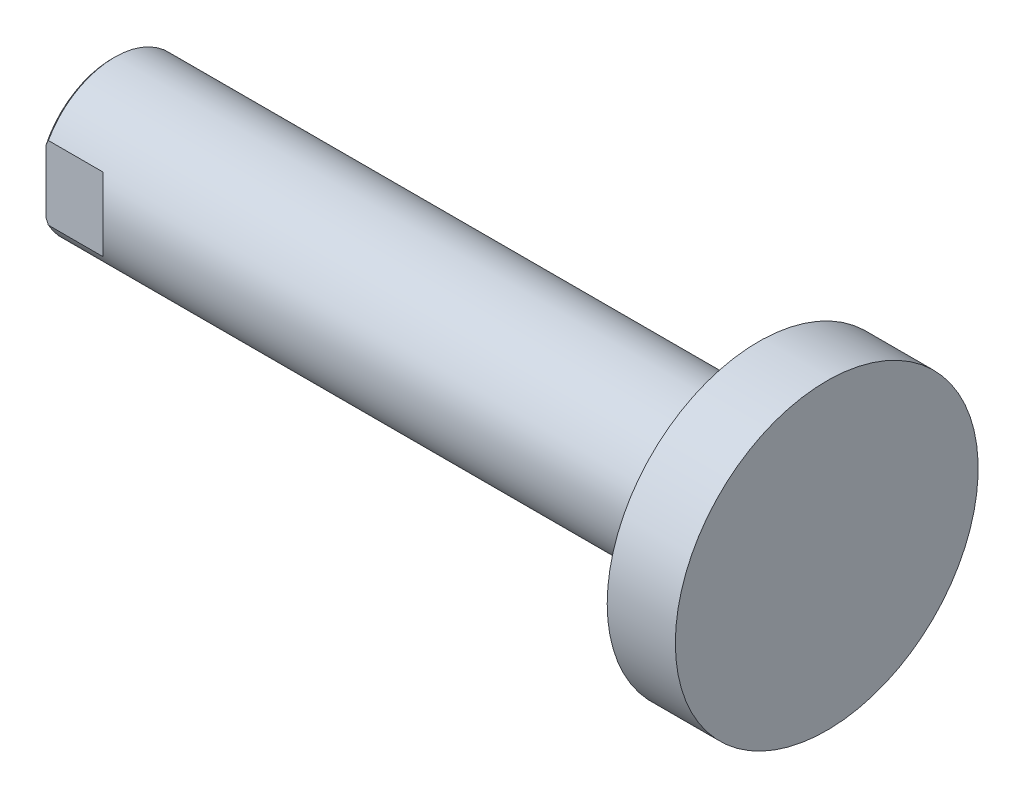
from build123d import *

# Parameters (mm, degrees)
CUT_EXTRUDE_1_DEPTH       = 14
CUT_EXTRUDE_1_DEPTH_BACK  = 14
HOLE_WIZARD_1_D           = 6.647
HOLE_WIZARD_1_DEPTH       = 15.6
HOLE_WIZARD_1_CSINK_D     = 8
HOLE_WIZARD_1_CSINK_ANGLE = 90
HOLE_WIZARD_1_TIP         = 1.91882362


with BuildPart() as part:
    # 草图1 → 旋转1 (revolve)
    with BuildSketch(Plane.XY):
        Polygon((-7, 0), (-7, 7.75), (-6.75, 8), (0, 8), (0, 0), align=None)
    revolve(axis=Axis((0, 0, 0), (-1, 0, 0)))

    # 草图2 → 旋转2 (revolve)
    with BuildSketch(Plane.XY):
        Polygon((0, 0), (0, 8), (61.3, 8), (61.3, 16), (68.5, 16), (68.5, 0), align=None)
    revolve(axis=Axis((68.5, 0, 0), (-1, 0, 0)))

    # 草图3 → 切除-拉伸1 (cut, two sides: drawn at the far end of the back side and taken through both)
    with BuildSketch(Plane(origin=(0, 0, 0), x_dir=(1, 0, 0), z_dir=(0, 1, 0)).offset(-CUT_EXTRUDE_1_DEPTH_BACK)):
        Polygon((-17, -12), (4, -12), (-1, -7), (-7, -7), (-7, 7), (-1, 7), (4, 12), (-17, 12), align=None)
    extrude(amount=CUT_EXTRUDE_1_DEPTH + CUT_EXTRUDE_1_DEPTH_BACK, mode=Mode.SUBTRACT)

    # 孔1
    with Locations(Plane.ZY.offset(7)):
        with Locations((0, 0)):
            CounterSinkHole(HOLE_WIZARD_1_D / 2, HOLE_WIZARD_1_CSINK_D / 2, depth=HOLE_WIZARD_1_DEPTH, counter_sink_angle=HOLE_WIZARD_1_CSINK_ANGLE)
            with Locations((0, 0, -(HOLE_WIZARD_1_DEPTH + HOLE_WIZARD_1_TIP / 2))):  # 120° drill point
                Cone(0, HOLE_WIZARD_1_D / 2, HOLE_WIZARD_1_TIP, mode=Mode.SUBTRACT)


solid = part.part
